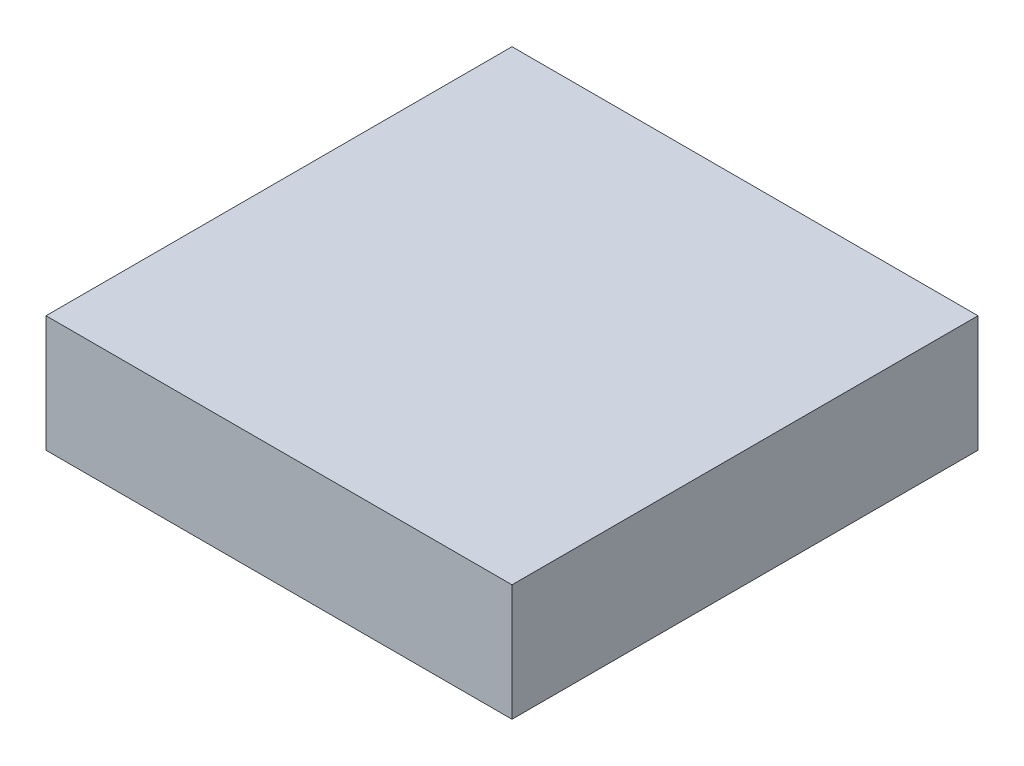
from build123d import *

# Parameters (mm, degrees)
OVEN_SPREY_NOZUL_TUTUCU_1_START = -220
SKETCH1_W                       = 40
SKETCH1_H                       = 10
OVEN_SPREY_NOZUL_TUTUCU_1_DEPTH = 40


with BuildPart() as part:
    # Sketch1 → OVEN_sprey_nozul_tutucu_1 (new body)
    with BuildSketch(Plane.XY.offset(OVEN_SPREY_NOZUL_TUTUCU_1_START)):
        with Locations((350, 1085)):
            Rectangle(SKETCH1_W, SKETCH1_H)
    extrude(amount=-OVEN_SPREY_NOZUL_TUTUCU_1_DEPTH)


solid = part.part
